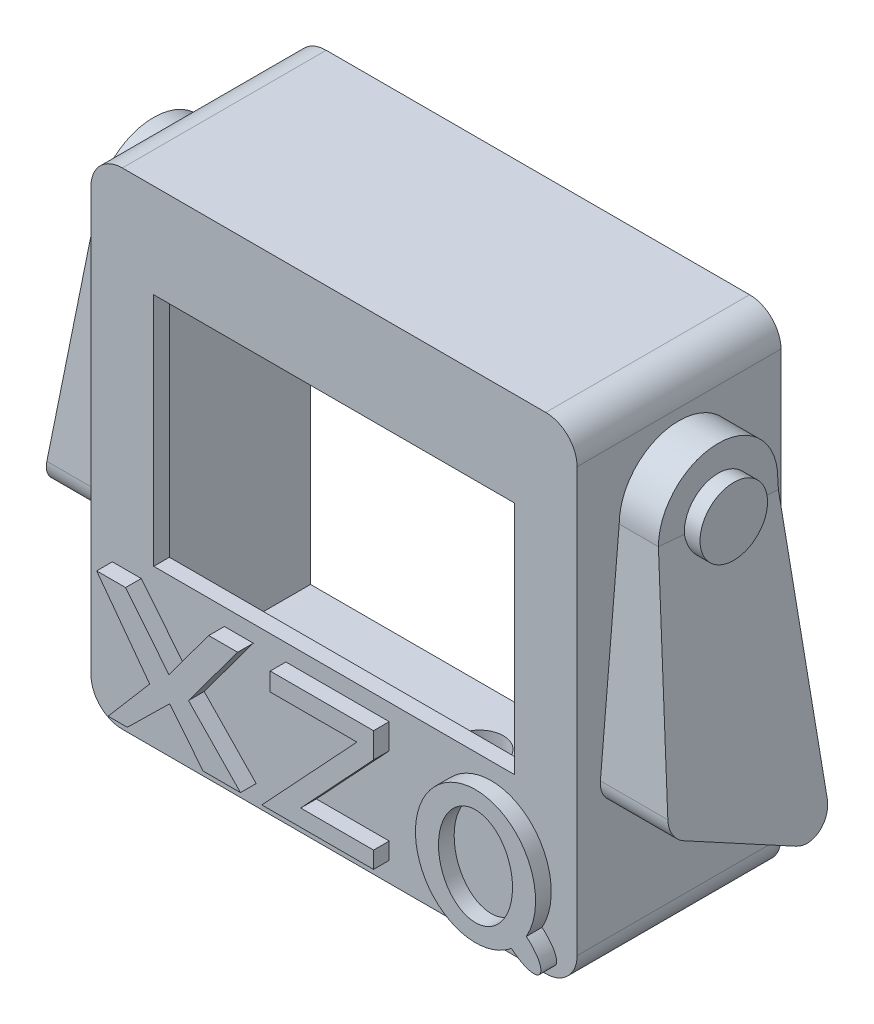
from build123d import *

# Parameters (mm, degrees)
SKETCH_1_W          = 29
SKETCH_1_H          = 29
EXTRUDE_1_DEPTH     = 1
SKETCH_2_W          = 31
SKETCH_2_H          = 31
SKETCH_2_W_2        = 29
SKETCH_2_H_2        = 29
EXTRUDE_2_DEPTH     = 13
EXTRUDE_4_DEPTH     = 5
CUT_EXTRUDE_START   = -14
CUT_EXTRUDE_2_DEPTH = 27
SKETCH_5_R          = 2.15366908
EXTRUDE_5_DEPTH     = 1
FILLET_2_R          = 2
FILLET_3_R          = 1.5
SKETCH_6_R          = 1.5
CUT_EXTRUDE_3_DEPTH = 10
SKETCH_7_RX         = 3.115871069
SKETCH_7_RY         = 2.3606007
EXTRUDE_6_DEPTH     = 1


with BuildPart() as part:
    # 草图1 → 凸台-拉伸1 (new body)
    with BuildSketch(Plane.XY):
        Rectangle(SKETCH_1_W, SKETCH_1_H)
        Polygon((-11.5, 0), (-11.5, 9.5), (11.5, 9.5), (11.5, -5.5), (-11.5, -5.5), align=None, mode=Mode.SUBTRACT)
    extrude(amount=EXTRUDE_1_DEPTH)

    # 草图2 → 凸台-拉伸2 (add)
    with BuildSketch(Plane.XY.offset(1)):
        Rectangle(SKETCH_2_W, SKETCH_2_H)
        Rectangle(SKETCH_2_W_2, SKETCH_2_H_2, mode=Mode.SUBTRACT)
    extrude(amount=-EXTRUDE_2_DEPTH)

    # 草图3 → 凸台-拉伸4 (add)
    with BuildSketch(Plane(origin=(15.5, 0, 0), x_dir=(0, 0, -1), z_dir=(1, 0, 0))):
        with BuildLine():
            Line((1.684082639, 8.989995997), (0.397094894, -5.595641246))
            Line((0.397094894, -5.595641246), (10.451208148, -10.79214922))
            Line((10.451208148, -10.79214922), (9.295909354, 8.989995997))
            ThreePointArc((9.295909354, 8.989995997), (5.489995997, 12.795909354), (1.684082639, 8.989995997))
        make_face()
    extrude_4 = extrude(amount=EXTRUDE_4_DEPTH)

    # 草图4 → 切除-拉伸2 (cut)
    with BuildSketch(Plane(origin=(0, -0.077997079, -0.883953322), x_dir=(1, 0, 0), z_dir=(0, 0.08789514896151537, 0.9961297319069606)).offset(CUT_EXTRUDE_START)):
        Polygon((18, 9.103224997), (20.5, -9.831770213), (20.5, 13.243659675), (18, 13.243659675), align=None)
    cut_extrude_2 = extrude(amount=CUT_EXTRUDE_2_DEPTH, mode=Mode.SUBTRACT)

    # 草图5 → 凸台-拉伸5 (add)
    with BuildSketch(Plane(origin=(18, 0, 0), x_dir=(0, 0, -1), z_dir=(1, 0, 0))):
        with Locations((5.489995997, 8.989995997)):
            Circle(SKETCH_5_R)
    extrude_5 = extrude(amount=EXTRUDE_5_DEPTH)

    # 镜向1: 凸台-拉伸4, 切除-拉伸2, 凸台-拉伸5 across plane
    add(extrude_4.mirror(Plane(origin=(0, 0, 0), x_dir=(0, 0, 1), z_dir=(1, 0, 0))))
    add(cut_extrude_2.mirror(Plane(origin=(0, 0, 0), x_dir=(0, 0, 1), z_dir=(1, 0, 0))), mode=Mode.SUBTRACT)
    add(extrude_5.mirror(Plane(origin=(0, 0, 0), x_dir=(0, 0, 1), z_dir=(1, 0, 0))))

    # 圆角2
    fillet_2_edges = [part.edges().sort_by_distance(p)[0] for p in [
        (15.5, -15.5, -5.5),
        (15.5, 15.5, -5.5),
        (-15.5, 15.5, -5.5),
        (-15.5, -15.5, -5.5),
    ]]
    fillet(fillet_2_edges, radius=FILLET_2_R)

    # 圆角3
    fillet_3_edges = [part.edges().sort_by_distance(p)[0] for p in [
        (18, -10.79214922, -10.451208148),
        (17.716616755, -5.595641246, -0.397094894),
        (-18, -10.79214922, -10.451208148),
        (-17.716616755, -5.595641246, -0.397094894),
    ]]
    fillet(fillet_3_edges, radius=FILLET_3_R)

    # 草图6 → 切除-拉伸3 (cut)
    with BuildSketch(Plane(origin=(0, -14.5, 0), x_dir=(1, 0, 0), z_dir=(0, 1, 0))):
        with Locations((0, 8.292466775)):
            Circle(SKETCH_6_R)
    extrude(amount=-CUT_EXTRUDE_3_DEPTH, mode=Mode.SUBTRACT)

    # 草图7 → 凸台-拉伸6 (add)
    # profile 1 of 3: a face of its own
    with BuildSketch(Plane.XY.offset(1)):
        Polygon((-14.13707497, -6.569596288), (-12.29339398, -6.569596288), (-9.531936558, -9.999148248), (-6.993177314, -6.569596288), (-5.148542266, -6.569596288), (-8.282186736, -10.802765134), (-4.967091233, -14.230413654), (-7.35222414, -14.230413654), (-9.483652502, -11.583317139), (-12.183939304, -14.230413654), (-13.406884876, -14.230413654), (-10.757959228, -11.129248682), align=None)
    # profile 2 of 3: a face of its own
    with BuildSketch(Plane.XY.offset(1)):
        Polygon((-3.07368936, -6.569596288), (3.518176746, -6.569596288), (3.518176746, -8.181354333), (-1.127695874, -13.161462393), (3.518176746, -13.161462393), (3.518176746, -14.230413654), (-3.60816499, -14.230413654), (2.458193197, -7.72762682), (-3.07368936, -7.72762682), align=None)
    # profile 3 of 3: a face of its own
    with BuildSketch(Plane.XY.offset(1)):
        with BuildLine():
            add(Edge.make_bspline(
                [(13.257578349, -13.064625962), (16.352824865, -7.664798791), (10.641635787, -6.629296303), (4.930446709, -5.593793814), (6.299215158, -11.802996851), (7.667983606, -18.012199887), (12.309307415, -14.194426658)],
                knots=[1.006525836, 1.006525836, 1.006525836, 2.978836938, 2.978836938, 4.95114804, 4.95114804, 6.923459142, 6.923459142, 6.923459142], degree=2, weights=[1, 0.551899857, 1, 0.551899857, 1, 0.551899857, 1]))
            add(Edge.make_bspline(
                [(12.309307415, -14.194426658), (13.611329655, -15.324791628), (14.10540557, -14.736133584), (14.599481485, -14.147475541), (13.257578349, -13.064625962)],
                knots=[4.671290612, 4.671290612, 4.671290612, 6.282456981, 6.282456981, 7.89362335, 7.89362335, 7.89362335], degree=2, weights=[1, 0.69269074, 1, 0.69269074, 1]))
        make_face()
        with Locations(Location((10.02096358, -10.802765134), (0, 0, -90))):
            Ellipse(SKETCH_7_RX, SKETCH_7_RY, mode=Mode.SUBTRACT)
    extrude(amount=EXTRUDE_6_DEPTH)


solid = part.part
